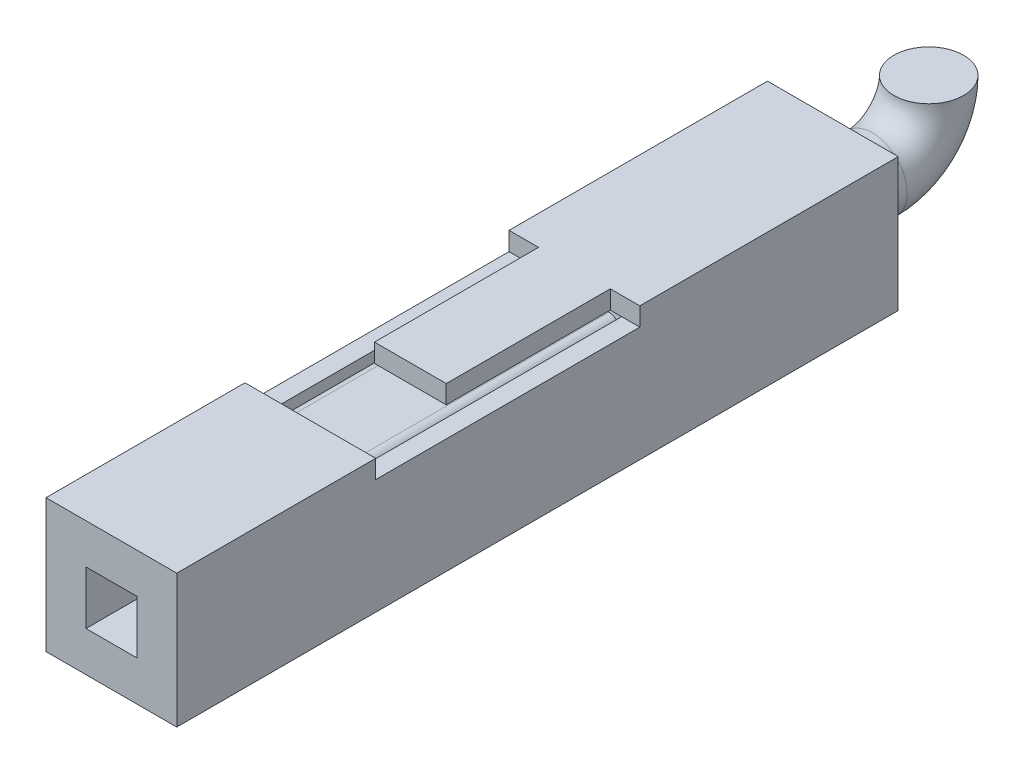
from build123d import *

# Parameters (mm, degrees)
SKETCH1_W           = 2.55
SKETCH1_H           = 2.6
SKETCH1_W_2         = 0.99
SKETCH1_H_2         = 1.04
BOSS_EXTRUDE1_DEPTH = 14.07
CUT_EXTRUDE1_REACH  = 16.358
SKETCH2_W           = 5.15
SKETCH2_H           = 0.36
SKETCH3_W           = 1.843846154
SKETCH3_H           = 1.88
CUT_EXTRUDE2_DEPTH  = 12
SKETCH4_W           = 1.4
SKETCH4_H           = 3.2
BOSS_EXTRUDE2_DEPTH = 0.36
SKETCH5_W           = 1.750648116
SKETCH5_H           = 1.78497455
SKETCH5_W_2         = 1.550648116
SKETCH5_H_2         = 1.58497455
BOSS_EXTRUDE3_DEPTH = 6.96
FILLET1_R           = 0.2
FILLET2_R           = 0.2
SKETCH7_R           = 0.68


with BuildPart() as part:
    # Sketch1 → Boss-Extrude1 (new body)
    with BuildSketch(Plane.XY):
        Rectangle(SKETCH1_W, SKETCH1_H)
        Rectangle(SKETCH1_W_2, SKETCH1_H_2, mode=Mode.SUBTRACT)
    extrude(amount=BOSS_EXTRUDE1_DEPTH)

    # Sketch2 → Cut-Extrude1 (cut, up to next)
    with BuildSketch(Plane.ZY.offset(1.275), mode=Mode.PRIVATE) as cut_extrude1_sk1:
        with Locations((7.615, 1.12)):
            Rectangle(SKETCH2_W, SKETCH2_H)
    cut_extrude1_tool1 = extrude(cut_extrude1_sk1.sketch, amount=-CUT_EXTRUDE1_REACH, mode=Mode.PRIVATE) & part.part
    add(cut_extrude1_tool1.solids().sort_by_distance((-1.275, 1.12, 7.615))[0], mode=Mode.SUBTRACT)

    # Sketch3 → Cut-Extrude2 (cut)
    with BuildSketch(Plane(origin=(0, 0, 0), x_dir=(-1, 0, 0), z_dir=(0, 0, -1))):
        Rectangle(SKETCH3_W, SKETCH3_H)
    extrude(amount=-CUT_EXTRUDE2_DEPTH, mode=Mode.SUBTRACT)

    # Sketch4 → Boss-Extrude2 (add)
    with BuildSketch(Plane(origin=(0, 1.3, 0), x_dir=(1, 0, 0), z_dir=(0, 1, 0))):
        with Locations((0, -6.64)):
            Rectangle(SKETCH4_W, SKETCH4_H)
    extrude(amount=-BOSS_EXTRUDE2_DEPTH)


with BuildPart() as body_2:
    # Sketch5 → Boss-Extrude3 (new body)
    with BuildSketch(Plane(origin=(0, 0, 12), x_dir=(-1, 0, 0), z_dir=(0, 0, -1))):
        Rectangle(SKETCH5_W, SKETCH5_H)
        Rectangle(SKETCH5_W_2, SKETCH5_H_2, mode=Mode.SUBTRACT)
    extrude(amount=BOSS_EXTRUDE3_DEPTH)

    # Fillet1
    fillet1_edges = [body_2.edges().sort_by_distance(p)[0] for p in [
        (-0.775324058, 0.792487275, 8.52),
        (0.775324058, 0.792487275, 8.52),
        (-0.775324058, -0.792487275, 8.52),
        (0.775324058, -0.792487275, 8.52),
    ]]
    fillet(fillet1_edges, radius=FILLET1_R)

    # Fillet2
    fillet2_edges = [body_2.edges().sort_by_distance(p)[0] for p in [
        (0.875324058, 0.892487275, 8.52),
        (-0.875324058, 0.892487275, 8.52),
        (-0.875324058, -0.892487275, 8.52),
        (0.875324058, -0.892487275, 8.52),
    ]]
    fillet(fillet2_edges, radius=FILLET2_R)


with BuildPart() as body_3:
    # Sweep2: sweep along a path in Sketch6
    with BuildLine(Plane(origin=(0, 0, 0), x_dir=(0, 0, -1), z_dir=(1, 0, 0))) as sweep2_path:
        Line((-5.04, 0), (0.769827469, 0))
        ThreePointArc((0.769827469, 0), (1.547766926, 0.322233074), (1.87, 1.100172531))
    # Sketch7 → Sweep2 (sweep)
    with BuildSketch(Plane(origin=(0, 0, 5.04), x_dir=(-1, 0, 0), z_dir=(0, 0, -1))):
        Circle(SKETCH7_R)
    sweep(path=sweep2_path.line)


solid = Compound([part.part, body_2.part, body_3.part])
